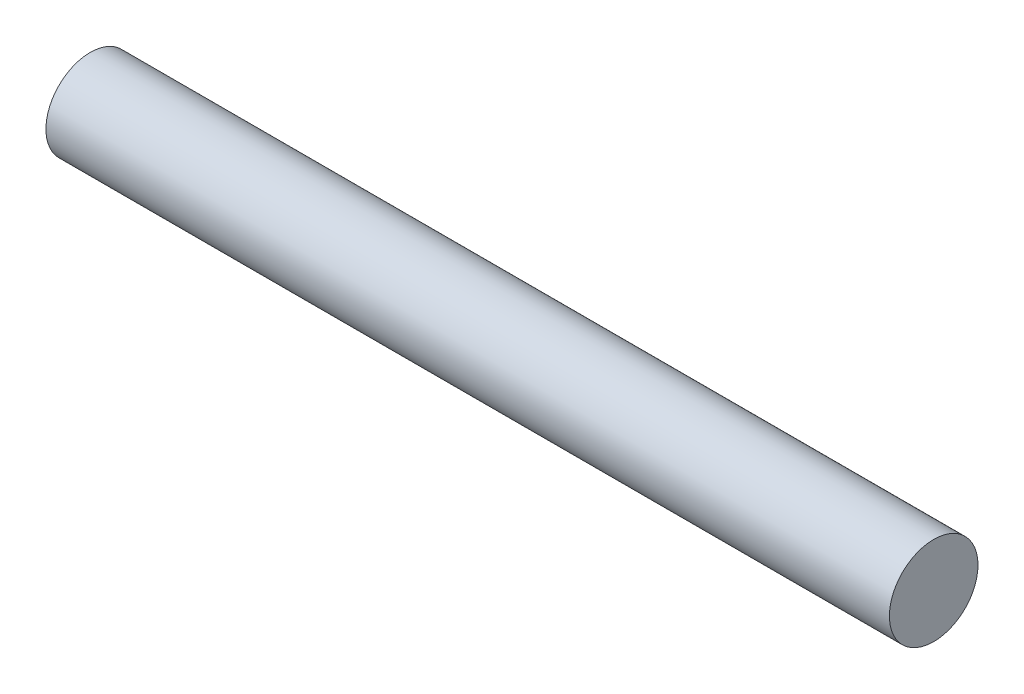
from build123d import *

# Parameters (mm, degrees)
SKETCH1_R           = 0.9779
BOSS_EXTRUDE1_DEPTH = 9.3091


with BuildPart() as part:
    # Sketch1 → Boss-Extrude1 (new, symmetric)
    with BuildSketch(Plane(origin=(0, 0, 0), x_dir=(0, 0, -1), z_dir=(1, 0, 0))):
        Circle(SKETCH1_R)
    extrude(amount=BOSS_EXTRUDE1_DEPTH, both=True)


solid = part.part
